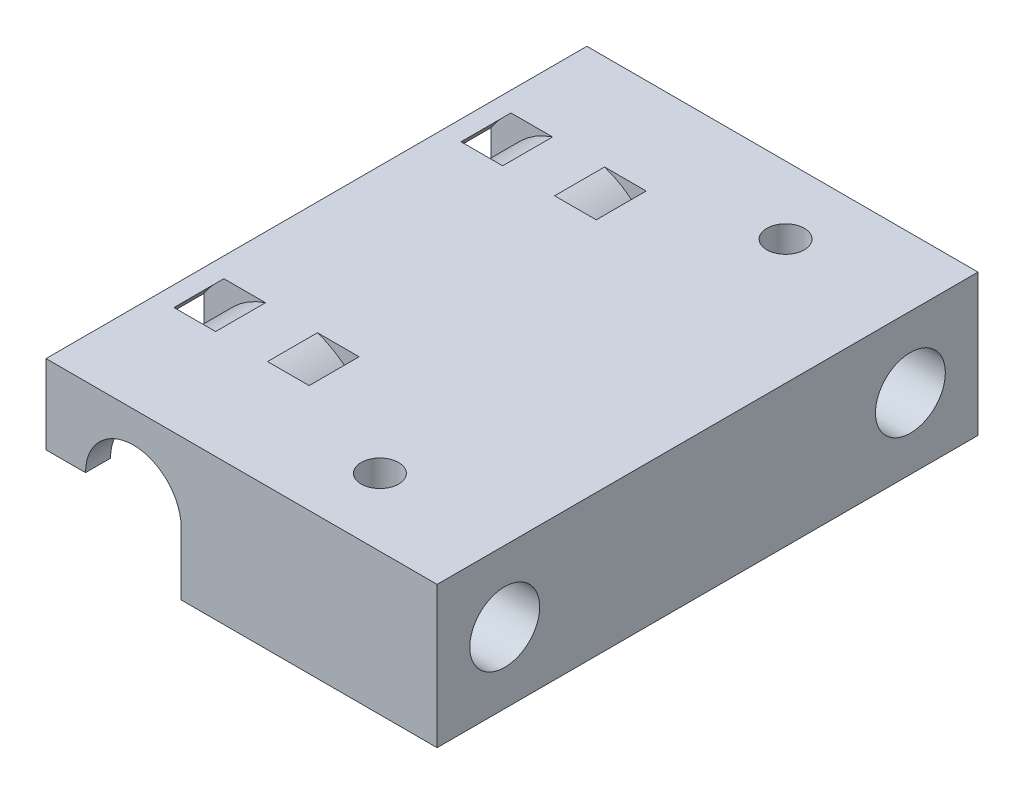
from build123d import *

# Parameters (mm, degrees)
SKETCH_1_W          = 47
SKETCH_1_H          = 65
EXTRUDE_1_DEPTH     = 17
CUT_EXTRUDE_1_DEPTH = 59
CUT_EXTRUDE_2_DEPTH = 79.571641677
EXTRUDE_2_DEPTH     = 10
SKETCH_7_R          = 4.2
CUT_EXTRUDE_3_DEPTH = 10
SKETCH_8_R          = 2.25
CUT_EXTRUDE_4_DEPTH = 79.571641677
CUT_EXTRUDE_5_DEPTH = 10
CUT_EXTRUDE_START   = -10
SKETCH_10_R         = 12.5
SKETCH_10_R_2       = 10
CUT_EXTRUDE_6_DEPTH = 6
CUT_EXTRUDE_START_2 = -20
SKETCH_11_R         = 12.5
SKETCH_11_R_2       = 10
CUT_EXTRUDE_7_DEPTH = 6


with BuildPart() as part:
    # Эскиз1 → Бобышка-Вытянуть1 (new body)
    with BuildSketch(Plane(origin=(0, 0, 0), x_dir=(1, 0, 0), z_dir=(0, 1, 0))):
        with Locations((-17.236996401, 32.5)):
            Rectangle(SKETCH_1_W, SKETCH_1_H)
    extrude(amount=EXTRUDE_1_DEPTH)

    # Эскиз2 → Вырез-Вытянуть1 (cut)
    with BuildSketch(Plane.XY.offset(-3)):
        with BuildLine():
            Line((-22.486996401, 7.5), (-22.486996401, 0))
            Line((-22.486996401, 0), (-40.736996401, 0))
            Line((-40.736996401, 0), (-40.736996401, 7.5))
            Line((-40.736996401, 7.5), (-37.986996401, 7.5))
            ThreePointArc((-37.986996401, 7.5), (-30.236996401, 15.25), (-22.486996401, 7.5))
        make_face()
    extrude(amount=-CUT_EXTRUDE_1_DEPTH, mode=Mode.SUBTRACT)

    # Эскиз5 → Вырез-Вытянуть2 (cut, through all)
    with BuildSketch(Plane.XY):
        with BuildLine():
            Line((-35.986996401, 7.5), (-40.736996401, 7.5))
            Line((-40.736996401, 7.5), (-40.736996401, 0))
            Line((-40.736996401, 0), (-24.486996401, 0))
            Line((-24.486996401, 0), (-24.486996401, 7.5))
            ThreePointArc((-24.486996401, 7.5), (-30.236996401, 13.25), (-35.986996401, 7.5))
        make_face()
    extrude(amount=-CUT_EXTRUDE_2_DEPTH, mode=Mode.SUBTRACT)

    # Эскиз6 → Бобышка-Вытянуть2 (add)
    with BuildSketch(Plane.XY.offset(-27.5)):
        with BuildLine():
            Line((-35.986996401, 7.5), (-40.736996401, 7.5))
            Line((-40.736996401, 7.5), (-40.736996401, 17))
            Line((-40.736996401, 17), (-24.486996401, 17))
            Line((-24.486996401, 17), (-22.486996401, 17))
            Line((-22.486996401, 17), (-22.486996401, 0))
            Line((-22.486996401, 0), (-24.486996401, 0))
            Line((-24.486996401, 0), (-24.486996401, 7.5))
            ThreePointArc((-24.486996401, 7.5), (-30.236996401, 13.25), (-35.986996401, 7.5))
        make_face()
    extrude(amount=-EXTRUDE_2_DEPTH)

    # Эскиз7 → Вырез-Вытянуть3 (cut)
    with BuildSketch(Plane(origin=(6.263003599, 0, 0), x_dir=(0, 0, -1), z_dir=(1, 0, 0))):
        with Locations((8.125, 8.5)):
            Circle(SKETCH_7_R)
        with Locations((56.875, 8.5)):
            Circle(SKETCH_7_R)
    extrude(amount=-CUT_EXTRUDE_3_DEPTH, mode=Mode.SUBTRACT)

    # Эскиз8 → Вырез-Вытянуть4 (cut, through all)
    with BuildSketch(Plane(origin=(0, 17, 0), x_dir=(1, 0, 0), z_dir=(0, 1, 0))):
        with Locations(Location((-8.736996401, 8.125, 0), (0, 0, 270))):
            Circle(SKETCH_8_R)
        with Locations(Location((-8.736996401, 56.875, 0), (0, 0, 270))):
            Circle(SKETCH_8_R)
    extrude(amount=-CUT_EXTRUDE_4_DEPTH, mode=Mode.SUBTRACT)

    # Эскиз9 → Вырез-Вытянуть5 (cut)
    with BuildSketch(Plane.XZ):
        Polygon((-4.406869382, -56.875), (-6.571932892, -53.125), (-10.902059911, -53.125), (-13.06712342, -56.875), (-10.902059911, -60.625), (-6.571932892, -60.625), align=None)
        Polygon((-4.406869382, -8.125), (-6.571932892, -4.375), (-10.902059911, -4.375), (-13.06712342, -8.125), (-10.902059911, -11.875), (-6.571932892, -11.875), align=None)
    extrude(amount=-CUT_EXTRUDE_5_DEPTH, mode=Mode.SUBTRACT)

    # Эскиз10 → Вырез-Вытянуть6 (cut)
    with BuildSketch(Plane.XY.offset(-3).offset(CUT_EXTRUDE_START)):
        with Locations((-30.236996401, 7.5)):
            Circle(SKETCH_10_R)
        with Locations((-30.236996401, 7.5)):
            Circle(SKETCH_10_R_2, mode=Mode.SUBTRACT)
    extrude(amount=-CUT_EXTRUDE_6_DEPTH, mode=Mode.SUBTRACT)

    # Эскиз11 → Вырез-Вытянуть7 (cut)
    with BuildSketch(Plane.XY.offset(-27.5).offset(CUT_EXTRUDE_START_2)):
        with Locations((-30.236996401, 7.5)):
            Circle(SKETCH_11_R)
        with Locations((-30.236996401, 7.5)):
            Circle(SKETCH_11_R_2, mode=Mode.SUBTRACT)
    extrude(amount=-CUT_EXTRUDE_7_DEPTH, mode=Mode.SUBTRACT)


solid = part.part
